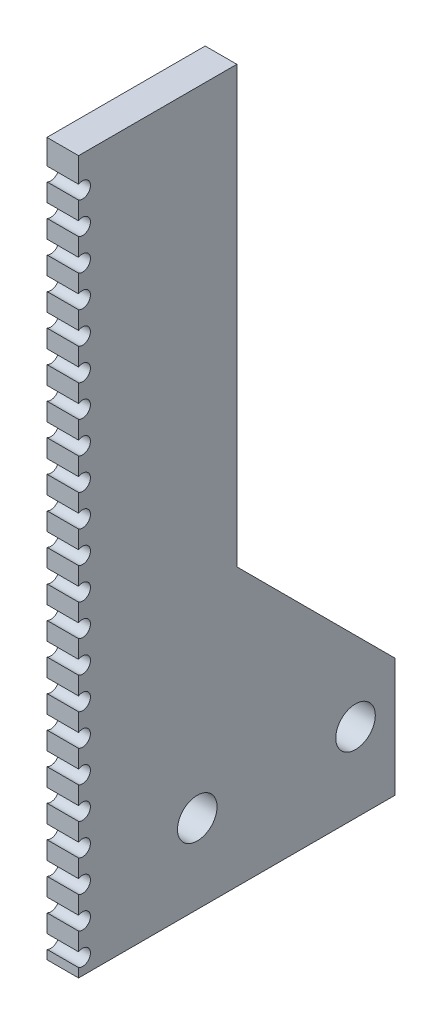
from build123d import *

# Parameters (mm, degrees)
SKETCH_1_R          = 2.5
EXTRUDE_1_DEPTH     = 4
SKETCH_2_R          = 1
CUT_EXTRUDE_1_DEPTH = 10


with BuildPart() as part:
    # Эскиз1 → Бобышка-Вытянуть1 (new body)
    with BuildSketch(Plane(origin=(0, 0, 0), x_dir=(0, 0, -1), z_dir=(1, 0, 0))):
        Polygon((40, 15), (20, 35), (20, 90), (0, 90), (0, 0), (40, 0), align=None)
        with Locations((15, 10)):
            Circle(SKETCH_1_R, mode=Mode.SUBTRACT)
        with Locations((35, 10)):
            Circle(SKETCH_1_R, mode=Mode.SUBTRACT)
    extrude(amount=EXTRUDE_1_DEPTH)

    # Эскиз2 → Вырез-Вытянуть1 (cut)
    with BuildSketch(Plane(origin=(4, 0, 0), x_dir=(0, 0, -1), z_dir=(1, 0, 0))):
        with Locations((0.5, 2)):
            Circle(SKETCH_2_R)
        with Locations((0.5, 6)):
            Circle(SKETCH_2_R)
        with Locations((0.5, 10)):
            Circle(SKETCH_2_R)
        with Locations((0.5, 14)):
            Circle(SKETCH_2_R)
        with Locations((0.5, 18)):
            Circle(SKETCH_2_R)
        with Locations((0.5, 22)):
            Circle(SKETCH_2_R)
        with Locations((0.5, 26)):
            Circle(SKETCH_2_R)
        with Locations((0.5, 30)):
            Circle(SKETCH_2_R)
        with Locations((0.5, 34)):
            Circle(SKETCH_2_R)
        with Locations((0.5, 38)):
            Circle(SKETCH_2_R)
        with Locations((0.5, 42)):
            Circle(SKETCH_2_R)
        with Locations((0.5, 46)):
            Circle(SKETCH_2_R)
        with Locations((0.5, 50)):
            Circle(SKETCH_2_R)
        with Locations((0.5, 54)):
            Circle(SKETCH_2_R)
        with Locations((0.5, 58)):
            Circle(SKETCH_2_R)
        with Locations((0.5, 62)):
            Circle(SKETCH_2_R)
        with Locations((0.5, 66)):
            Circle(SKETCH_2_R)
        with Locations((0.5, 70)):
            Circle(SKETCH_2_R)
        with Locations((0.5, 74)):
            Circle(SKETCH_2_R)
        with Locations((0.5, 78)):
            Circle(SKETCH_2_R)
        with Locations((0.5, 82)):
            Circle(SKETCH_2_R)
        with Locations((0.5, 86)):
            Circle(SKETCH_2_R)
    extrude(amount=-CUT_EXTRUDE_1_DEPTH, mode=Mode.SUBTRACT)


solid = part.part
